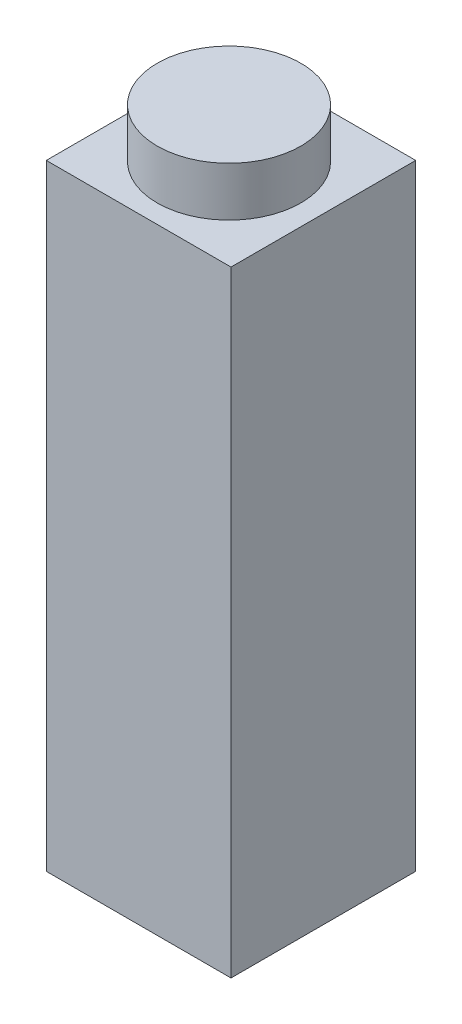
from build123d import *

# Parameters (mm, degrees)
SKETCH1_W           = 4.5
SKETCH1_H           = 4.5
BOSS_EXTRUDE1_DEPTH = 15
SKETCH2_R           = 1
CUT_EXTRUDE1_DEPTH  = 0.5
SKETCH4_R           = 1.75
BOSS_EXTRUDE2_DEPTH = 1.2


with BuildPart() as part:
    # Sketch1 → Boss-Extrude1 (new body)
    with BuildSketch(Plane(origin=(0, 0, 0), x_dir=(1, 0, 0), z_dir=(0, 1, 0))):
        Rectangle(SKETCH1_W, SKETCH1_H)
    extrude(amount=BOSS_EXTRUDE1_DEPTH)

    # Sketch2 → Cut-Extrude1 (cut)
    with BuildSketch(Plane.XZ):
        with Locations(Location((0, 0, 0), (0, 0, 270))):
            Circle(SKETCH2_R)
    extrude(amount=-CUT_EXTRUDE1_DEPTH, mode=Mode.SUBTRACT)

    # Sketch4 → Boss-Extrude2 (add)
    with BuildSketch(Plane(origin=(0, 15, 0), x_dir=(1, 0, 0), z_dir=(0, 1, 0))):
        with Locations(Location((0, -0.04771887, 0), (0, 0, 270))):
            Circle(SKETCH4_R)
    extrude(amount=BOSS_EXTRUDE2_DEPTH)


solid = part.part
